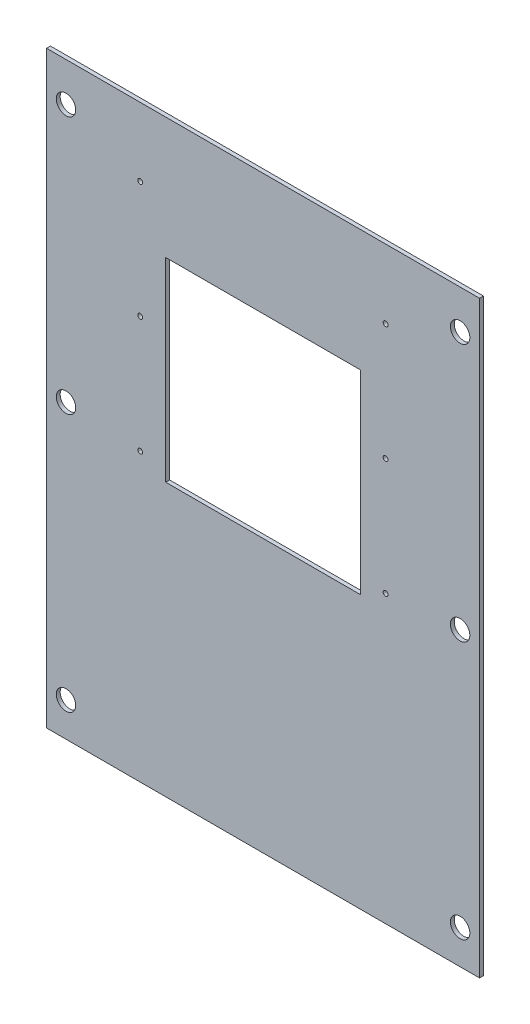
from build123d import *

# Parameters (mm, degrees)
SKETCH1_W           = 282.575
SKETCH1_H           = 384.175
SKETCH1_R           = 6.35
SKETCH1_R_2         = 1.5875
SKETCH1_W_2         = 127
SKETCH1_H_2         = 127
BOSS_EXTRUDE1_DEPTH = 2.54


with BuildPart() as part:
    # Sketch1 → Boss-Extrude1 (new body)
    with BuildSketch(Plane.XY):
        Rectangle(SKETCH1_W, SKETCH1_H)
        with Locations((-128.5875, 166.6875)):
            Circle(SKETCH1_R, mode=Mode.SUBTRACT)
        with Locations((-128.5875, -1.5875)):
            Circle(SKETCH1_R, mode=Mode.SUBTRACT)
        with Locations((-128.5875, -169.8625)):
            Circle(SKETCH1_R, mode=Mode.SUBTRACT)
        with Locations((128.5875, -1.5875)):
            Circle(SKETCH1_R, mode=Mode.SUBTRACT)
        with Locations((128.5875, 166.6875)):
            Circle(SKETCH1_R, mode=Mode.SUBTRACT)
        with Locations((128.5875, -169.8625)):
            Circle(SKETCH1_R, mode=Mode.SUBTRACT)
        with Locations((-80.175152311, 147.376386757)):
            Circle(SKETCH1_R_2, mode=Mode.SUBTRACT)
        with Locations((-80.175152311, 71.176386757)):
            Circle(SKETCH1_R_2, mode=Mode.SUBTRACT)
        with Locations((-80.175152311, -5.023613243)):
            Circle(SKETCH1_R_2, mode=Mode.SUBTRACT)
        with Locations((79.970650499, -5.395164494)):
            Circle(SKETCH1_R_2, mode=Mode.SUBTRACT)
        with Locations((79.970650499, 70.804835506)):
            Circle(SKETCH1_R_2, mode=Mode.SUBTRACT)
        with Locations((79.970650499, 147.004835506)):
            Circle(SKETCH1_R_2, mode=Mode.SUBTRACT)
        with Locations((-0.006402311, 49.2125)):
            Rectangle(SKETCH1_W_2, SKETCH1_H_2, mode=Mode.SUBTRACT)
    extrude(amount=BOSS_EXTRUDE1_DEPTH)


solid = part.part
